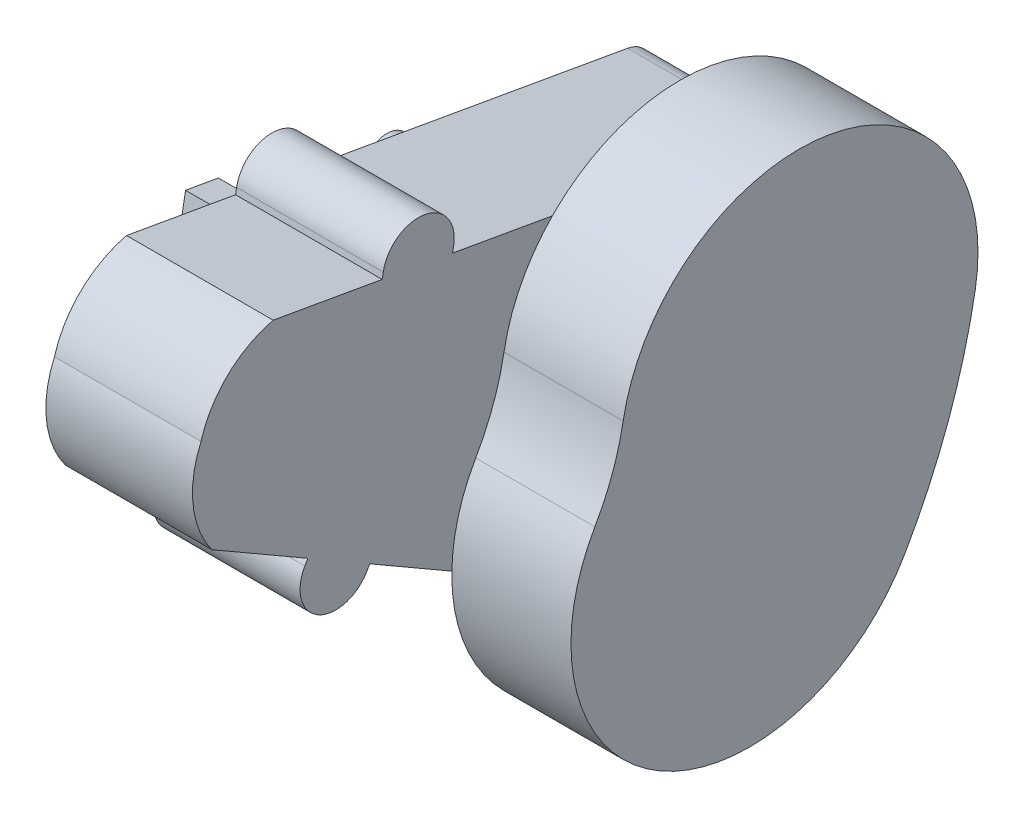
from build123d import *

# Parameters (mm, degrees)
BOSS_EXTRUDE2_DEPTH = 24.6
BOSS_EXTRUDE3_DEPTH = 4
BOSS_EXTRUDE4_DEPTH = 10.2
BOSS_EXTRUDE5_DEPTH = 20


with BuildPart() as part:
    # Sketch7 → Boss-Extrude2 (new body)
    with BuildSketch(Plane(origin=(21.6, 0, 0), x_dir=(0, 0, -1), z_dir=(1, 0, 0))):
        with BuildLine():
            Line((-7.625, -13.206887408), (8.466613981, -22.497385071))
            Line((8.466613981, -22.497385071), (7.966613981, -23.363410475))
            ThreePointArc((7.966613981, -23.363410475), (10.162766404, -31.559562898), (18.358918826, -29.363410475))
            Line((18.358918826, -29.363410475), (18.858918826, -28.497385071))
            Line((18.858918826, -28.497385071), (66.316248975, -55.896887408))
            ThreePointArc((66.316248975, -55.896887408), (69.52544748, -56.516208588), (72.431605073, -55.020627828))
            ThreePointArc((72.431605073, -55.020627828), (85.473848311, -31.109936594), (90.852406417, -4.409892086))
            ThreePointArc((90.852406417, -4.409892086), (89.587501324, -1.396168663), (86.731020662, 0.192236824))
            Line((86.731020662, 0.192236824), (32.764536002, 9.707984124))
            Line((32.764536002, 9.707984124), (32.93818418, 10.692791877))
            ThreePointArc((32.93818418, 10.692791877), (28.071226728, 17.643527461), (21.120491144, 12.776570009))
            Line((21.120491144, 12.776570009), (20.946842966, 11.791762256))
            Line((20.946842966, 11.791762256), (2.648134709, 15.018318233))
            ThreePointArc((2.648134709, 15.018318233), (-4.966977399, 10.864576659), (-9.454073405, 3.441001312))
            ThreePointArc((-9.454073405, 3.441001312), (-10.788540697, -5.130037047), (-7.625, -13.206887408))
        make_face()
    extrude(amount=-BOSS_EXTRUDE2_DEPTH)

    # Sketch10 → Boss-Extrude3 (add)
    with BuildSketch(Plane.ZY.offset(3)):
        with BuildLine():
            ThreePointArc((-54.346189903, 0.008194309), (-51.068714201, -18.587491871), (-41.62632958, -34.939334709))
            ThreePointArc((-41.62632958, -34.939334709), (-35.990927094, -35.431512343), (-35.49874946, -29.796109857))
            ThreePointArc((-35.49874946, -29.796109857), (-43.551173234, -15.851330725), (-46.346189994, 0.006988071))
            ThreePointArc((-46.346189994, 0.006988071), (-50.34558683, 4.007591145), (-54.346189903, 0.008194309))
        make_face()
    extrude(amount=BOSS_EXTRUDE3_DEPTH)

    # Sketch13 → Boss-Extrude4 (add)
    with BuildSketch(Plane.ZY.offset(3)):
        with BuildLine():
            Line((-10.671230148, -12.078877858), (-14.135331763, -14.078877858))
            ThreePointArc((-14.135331763, -14.078877858), (-15.067183416, -15.293290575), (-14.867382571, -16.810928665))
            Line((-14.867382571, -16.810928665), (-13.157382571, -19.772735546))
            Line((-13.157382571, -19.772735546), (-18.007124832, -22.572735546))
            Line((-18.007124832, -22.572735546), (-18.717124832, -21.342979473))
            ThreePointArc((-18.717124832, -21.342979473), (-19.93153755, -20.41112782), (-21.44917564, -20.610928665))
            Line((-21.44917564, -20.610928665), (-24.480264553, -22.360928665))
            ThreePointArc((-24.480264553, -22.360928665), (-31.086634735, -11.450140853), (-33.08288647, 1.147652472))
            Line((-33.08288647, 1.147652472), (-29.636059334, 1.755421094))
            ThreePointArc((-29.636059334, 1.755421094), (-28.345051601, 2.577883728), (-28.013740184, 4.072332956))
            Line((-28.013740184, 4.072332956), (-28.260320596, 5.470759965))
            Line((-28.260320596, 5.470759965), (-22.745397179, 6.44318976))
            Line((-22.745397179, 6.44318976), (-22.151520411, 3.075147244))
            ThreePointArc((-22.151520411, 3.075147244), (-21.329057778, 1.784139511), (-19.83460855, 1.452828094))
            Line((-19.83460855, 1.452828094), (-15.895377538, 2.147420804))
            ThreePointArc((-15.895377538, 2.147420804), (-13.915890879, -5.198025626), (-10.671230148, -12.078877858))
        make_face()
    extrude(amount=BOSS_EXTRUDE4_DEPTH)


with BuildPart() as body_2:
    # Sketch14 → Boss-Extrude5 (new body)
    with BuildSketch(Plane(origin=(43.6, 0, 0), x_dir=(0, 0, -1), z_dir=(1, 0, 0))):
        with BuildLine():
            ThreePointArc((98.456843338, -17.5), (74.169790336, 17.287053001), (39.382737335, -7))
            ThreePointArc((39.382737335, -7), (37.578305178, -13.706603516), (34.641016151, -20))
            ThreePointArc((34.641016151, -20), (45.621778265, -60.980762114), (86.602540378, -50))
            ThreePointArc((86.602540378, -50), (93.945762945, -34.26650879), (98.456843338, -17.5))
        make_face()
    extrude(amount=-BOSS_EXTRUDE5_DEPTH)


solid = Compound([part.part, body_2.part])
